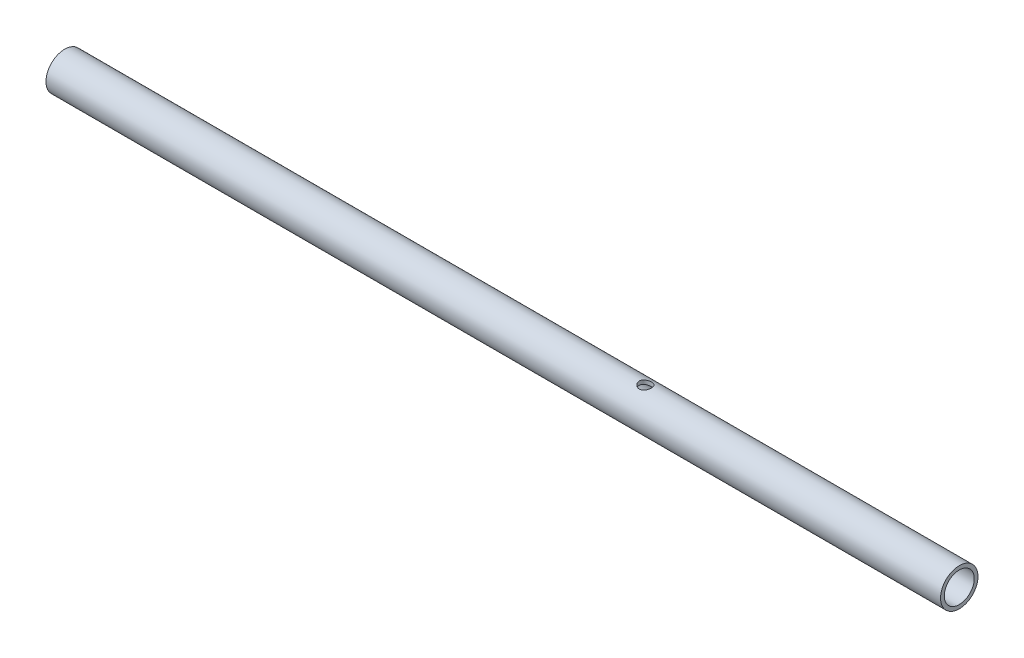
from build123d import *

# Parameters (mm, degrees)
BOSS_EXTRUDE1_DEPTH      = 355
BOSS_EXTRUDE1_DEPTH_BACK = 600
SKETCH1_R                = 20
SKETCH1_R_2              = 16
SKETCH2_R                = 6.5
CUT_EXTRUDE1_DEPTH       = 28.5


with BuildPart() as part:
    # Sketch1 → Boss-Extrude1 (new, two sides: drawn at the far end of the back side and taken through both)
    with BuildSketch(Plane(origin=(0, 0, 0), x_dir=(0, 0, -1), z_dir=(1, 0, 0)).offset(-BOSS_EXTRUDE1_DEPTH_BACK)):
        Circle(SKETCH1_R)
        Circle(SKETCH1_R_2, mode=Mode.SUBTRACT)
    extrude(amount=BOSS_EXTRUDE1_DEPTH + BOSS_EXTRUDE1_DEPTH_BACK)

    # Sketch2 → Cut-Extrude1 (cut, symmetric)
    with BuildSketch(Plane(origin=(0, 0, 0), x_dir=(1, 0, 0), z_dir=(0, 1, 0))):
        with Locations(Location((20, 0, 0), (0, 0, 270))):
            Circle(SKETCH2_R)
    extrude(amount=CUT_EXTRUDE1_DEPTH, both=True, mode=Mode.SUBTRACT)


solid = part.part
